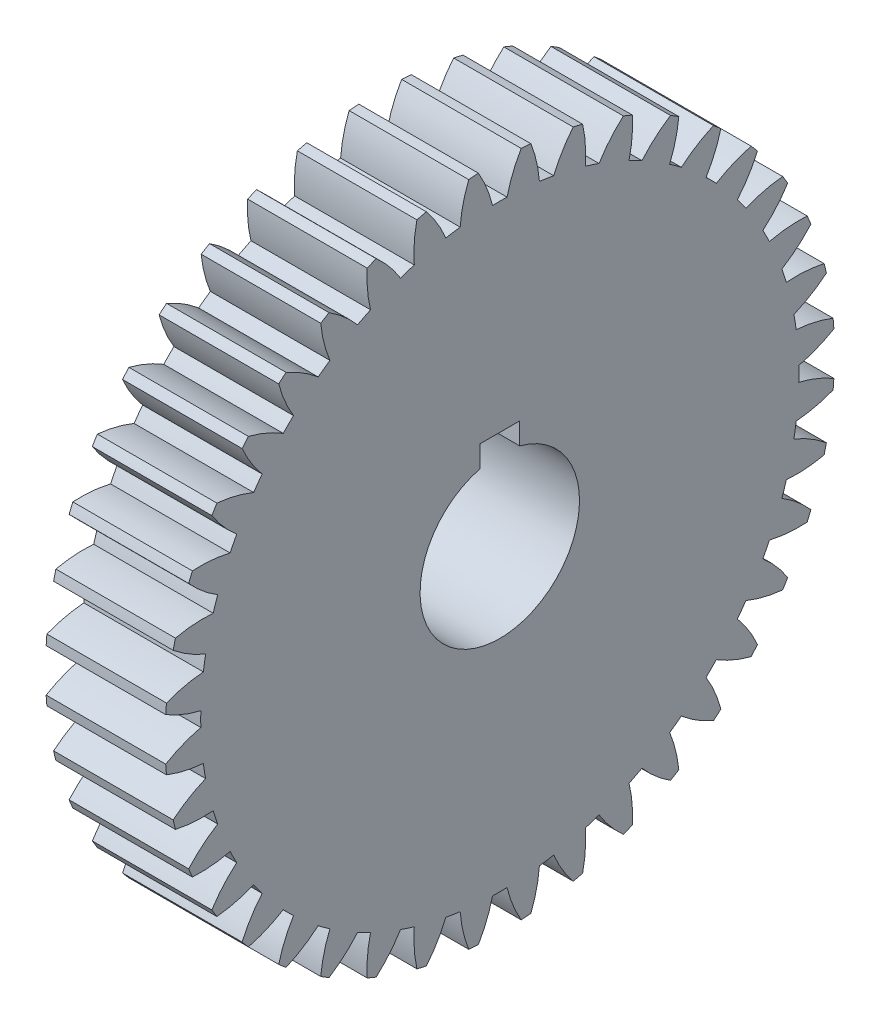
from build123d import *

# Parameters (mm, degrees)
BASPROSKE_W        = 9.525
BASPROSKE_H        = 26.67
TOOTHCUT_DEPTH     = 39.901200817
TEETHCUTS_COUNT    = 40
TEETHCUTS_ANGLE    = 351
HUBNEAONESKE_R     = 23.0124
HUBNEARONE_DEPTH   = 12.7000508
BORSKE_R           = 6.35
BORE_DEPTH         = 22.2250508
KEYSKE_W           = 3.175
KEYSKE_H           = 7.874
KEYWAY_DEPTH       = 22.2250508
CUT_EXTRUDE1_START = -12.7000508
SKETCH1_R          = 23.0124
SKETCH1_R_2        = 11.1125
CUT_EXTRUDE1_DEPTH = 12.7000508
CUT_EXTRUDE2_START = -5.08
SKETCH2_R          = 11.1125
CUT_EXTRUDE2_DEPTH = 5.08


with BuildPart() as part:
    # BasProSke → Base-Revolve (revolve)
    with BuildSketch(Plane(origin=(0, 0, 0), x_dir=(1, 0, 0), z_dir=(0, 1, 0)), mode=Mode.PRIVATE) as base_revolve_sk:
        with Locations((4.7625, 13.335)):
            Rectangle(BASPROSKE_W, BASPROSKE_H)
    revolve(base_revolve_sk.sketch.rotate(Axis((-10, 0, 0), (1, 0, 0)), 180), axis=Axis((-10, 0, 0), (1, 0, 0)))

    # TooCutSke → ToothCut (cut, through all)
    with BuildSketch(Plane(origin=(0, 0, 0), x_dir=(0, 0, -1), z_dir=(1, 0, 0))):
        with BuildLine():
            ThreePointArc((0.577296327, 23.818204886), (0, 23.8252), (-0.577296327, 23.818204886))
            ThreePointArc((-0.577296327, 23.818204886), (-1.042980967, 25.272123589), (-1.721261603, 26.639850594))
            ThreePointArc((-1.721261603, 26.639850594), (0, 26.6954), (1.721261603, 26.639850594))
            ThreePointArc((1.721261603, 26.639850594), (1.042980967, 25.272123589), (0.577296327, 23.818204886))
        make_face()
    toothcut = extrude(amount=TOOTHCUT_DEPTH, mode=Mode.SUBTRACT)

    # TeethCuts: ToothCut ×40 about axis
    teethcuts_axis = Axis((-10, 0, 0), (1, 0, 0))
    for i in range(1, TEETHCUTS_COUNT):
        add(toothcut.rotate(teethcuts_axis, i * TEETHCUTS_ANGLE / (TEETHCUTS_COUNT - 1)), mode=Mode.SUBTRACT)

    # HubNeaOneSke → HubNearOne (add)
    with BuildSketch(Plane.ZY):
        with Locations(Location((0, 0, 0), (0, 0, 180))):
            Circle(HUBNEAONESKE_R)
    extrude(amount=HUBNEARONE_DEPTH)

    # BorSke → Bore (cut, symmetric)
    with BuildSketch(Plane(origin=(0, 0, 0), x_dir=(0, 0, -1), z_dir=(1, 0, 0))):
        with Locations(Location((0, 0, 0), (0, 0, 180))):
            Circle(BORSKE_R)
    extrude(amount=BORE_DEPTH, both=True, mode=Mode.SUBTRACT)

    # KeySke → Keyway (cut, symmetric)
    with BuildSketch(Plane(origin=(0, 0, 0), x_dir=(0, 0, -1), z_dir=(1, 0, 0))):
        with Locations((0, 3.937)):
            Rectangle(KEYSKE_W, KEYSKE_H)
    extrude(amount=KEYWAY_DEPTH, both=True, mode=Mode.SUBTRACT)

    # Sketch1 → Cut-Extrude1 (cut)
    with BuildSketch(Plane.ZY.offset(12.7000508).offset(CUT_EXTRUDE1_START)):
        Circle(SKETCH1_R)
        Circle(SKETCH1_R_2, mode=Mode.SUBTRACT)
    extrude(amount=CUT_EXTRUDE1_DEPTH, mode=Mode.SUBTRACT)

    # Sketch2 → Cut-Extrude2 (cut)
    with BuildSketch(Plane.ZY.offset(12.7000508).offset(CUT_EXTRUDE2_START)):
        Circle(SKETCH2_R)
    extrude(amount=CUT_EXTRUDE2_DEPTH, mode=Mode.SUBTRACT)


solid = part.part
